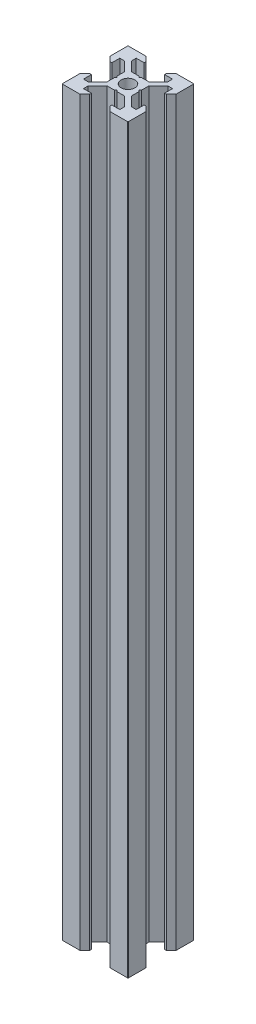
from build123d import *

# Parameters (mm, degrees)
ESQUISSE1_R        = 2.1
BOSS_EXTRU_1_DEPTH = 225


with BuildPart() as part:
    # Esquisse1 → Boss.-Extru.1 (new body)
    with BuildSketch(Plane(origin=(0, 0, 0), x_dir=(1, 0, 0), z_dir=(0, 1, 0))):
        with BuildLine():
            Line((3.7, 2.639339828), (6.560660172, 5.5))
            Line((6.560660172, 5.5), (8, 5.5))
            Line((8, 5.5), (8, 3.1))
            Line((8, 3.1), (8.52, 3.1))
            Line((8.52, 3.1), (10, 4.58))
            Line((10, 4.58), (10, 9.82))
            ThreePointArc((10, 9.82), (9.947279221, 9.947279221), (9.82, 10))
            Line((9.82, 10), (4.58, 10))
            Line((4.58, 10), (3.1, 8.52))
            Line((3.1, 8.52), (3.1, 8))
            Line((3.1, 8), (5.5, 8))
            Line((5.5, 8), (5.5, 6.560660172))
            Line((5.5, 6.560660172), (2.639339828, 3.7))
            Line((2.639339828, 3.7), (0.353553391, 3.7))
            Line((0.353553391, 3.7), (0, 3.346446609))
            Line((0, 3.346446609), (-0.353553391, 3.7))
            Line((-0.353553391, 3.7), (-2.639339828, 3.7))
            Line((-2.639339828, 3.7), (-5.5, 6.560660172))
            Line((-5.5, 6.560660172), (-5.5, 8))
            Line((-5.5, 8), (-3.1, 8))
            Line((-3.1, 8), (-3.1, 8.52))
            Line((-3.1, 8.52), (-4.58, 10))
            Line((-4.58, 10), (-9.82, 10))
            ThreePointArc((-9.82, 10), (-9.947279221, 9.947279221), (-10, 9.82))
            Line((-10, 9.82), (-10, 4.58))
            Line((-10, 4.58), (-8.52, 3.1))
            Line((-8.52, 3.1), (-8, 3.1))
            Line((-8, 3.1), (-8, 5.5))
            Line((-8, 5.5), (-6.560660172, 5.5))
            Line((-6.560660172, 5.5), (-3.7, 2.639339828))
            Line((-3.7, 2.639339828), (-3.7, 0.353553391))
            Line((-3.7, 0.353553391), (-3.346446609, 0))
            Line((-3.346446609, 0), (-3.7, -0.353553391))
            Line((-3.7, -0.353553391), (-3.7, -2.639339828))
            Line((-3.7, -2.639339828), (-6.560660172, -5.5))
            Line((-6.560660172, -5.5), (-8, -5.5))
            Line((-8, -5.5), (-8, -3.1))
            Line((-8, -3.1), (-8.52, -3.1))
            Line((-8.52, -3.1), (-10, -4.58))
            Line((-10, -4.58), (-10, -9.82))
            ThreePointArc((-10, -9.82), (-9.947279221, -9.947279221), (-9.82, -10))
            Line((-9.82, -10), (-4.58, -10))
            Line((-4.58, -10), (-3.1, -8.52))
            Line((-3.1, -8.52), (-3.1, -8))
            Line((-3.1, -8), (-5.5, -8))
            Line((-5.5, -8), (-5.5, -6.560660172))
            Line((-5.5, -6.560660172), (-2.639339828, -3.7))
            Line((-2.639339828, -3.7), (-0.353553391, -3.7))
            Line((-0.353553391, -3.7), (0, -3.346446609))
            Line((0, -3.346446609), (0.353553391, -3.7))
            Line((0.353553391, -3.7), (2.639339828, -3.7))
            Line((2.639339828, -3.7), (5.5, -6.560660172))
            Line((5.5, -6.560660172), (5.5, -8))
            Line((5.5, -8), (3.1, -8))
            Line((3.1, -8), (3.1, -8.52))
            Line((3.1, -8.52), (4.58, -10))
            Line((4.58, -10), (9.82, -10))
            ThreePointArc((9.82, -10), (9.947279221, -9.947279221), (10, -9.82))
            Line((10, -9.82), (10, -4.58))
            Line((10, -4.58), (8.52, -3.1))
            Line((8.52, -3.1), (8, -3.1))
            Line((8, -3.1), (8, -5.5))
            Line((8, -5.5), (6.560660172, -5.5))
            Line((6.560660172, -5.5), (3.7, -2.639339828))
            Line((3.7, -2.639339828), (3.7, -0.353553391))
            Line((3.7, -0.353553391), (3.346446609, 0))
            Line((3.346446609, 0), (3.7, 0.353553391))
            Line((3.7, 0.353553391), (3.7, 2.639339828))
        make_face()
        with Locations(Location((0, 0, 0), (0, 0, 270))):
            Circle(ESQUISSE1_R, mode=Mode.SUBTRACT)
    extrude(amount=BOSS_EXTRU_1_DEPTH)


solid = part.part
